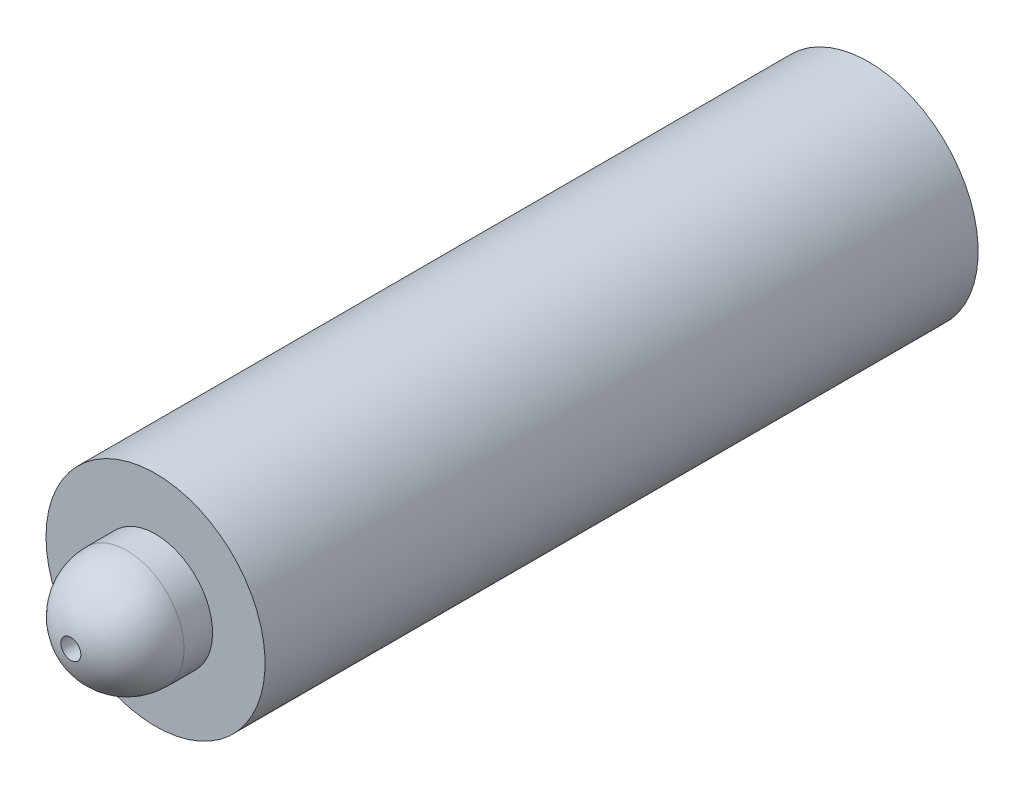
from build123d import *

# Parameters (mm, degrees)
SKETCH1_R           = 12.192
SKETCH1_R_2         = 9.017
CORE_EXTRUDE_DEPTH  = 79.375
GROOVE_CUT_DEPTH    = 19.05
BUMPY_START         = -3.175
SKETCH3_R           = 9.017
BUMPY_EXTRUDE_DEPTH = 3.175
SKETCH7_R           = 1.11125
CUT_EXTRUDE3_DEPTH  = 79.126370247


with BuildPart() as part:
    # Sketch1 → Core Extrude (new body)
    with BuildSketch(Plane.XY):
        with Locations(Location((0, 0, 0), (0, 0, 180))):
            Circle(SKETCH1_R)
        with Locations(Location((0, 0, 0), (0, 0, 180))):
            Circle(SKETCH1_R_2, mode=Mode.SUBTRACT)
    extrude(amount=CORE_EXTRUDE_DEPTH)

    # Sketch2 → Groove Cut (cut)
    with BuildSketch(Plane(origin=(0, 0, 0), x_dir=(-1, 0, 0), z_dir=(0, 0, -1))):
        with BuildLine():
            ThreePointArc((-8.439529845, -3.175), (-9.017, 0), (-8.439529845, 3.175))
            ThreePointArc((-8.439529845, 3.175), (-10.922, 0), (-8.439529845, -3.175))
        make_face()
        with BuildLine():
            ThreePointArc((-3.175, 8.439529845), (0, 9.017), (3.175, 8.439529845))
            ThreePointArc((3.175, 8.439529845), (0, 10.922), (-3.175, 8.439529845))
        make_face()
        with BuildLine():
            ThreePointArc((8.439529845, -3.175), (10.922, 0), (8.439529845, 3.175))
            ThreePointArc((8.439529845, 3.175), (8.871457874, 1.613543986), (9.017, 0))
            ThreePointArc((9.017, 0), (8.871457874, -1.613543986), (8.439529845, -3.175))
        make_face()
        with BuildLine():
            ThreePointArc((-3.175, -8.439529845), (0, -10.922), (3.175, -8.439529845))
            ThreePointArc((3.175, -8.439529845), (0, -9.017), (-3.175, -8.439529845))
        make_face()
    extrude(amount=-GROOVE_CUT_DEPTH, mode=Mode.SUBTRACT)

    # Sketch3 → Bumpy Extrude (add)
    with BuildSketch(Plane.XY.offset(79.375).offset(BUMPY_START)):
        with Locations(Location((0, 0, 0), (0, 0, 159.383409617))):
            Circle(SKETCH3_R)
    extrude(amount=BUMPY_EXTRUDE_DEPTH)

    # Sketch5 → Revolve1 (revolve)
    with BuildSketch(Plane(origin=(0, 0, 0), x_dir=(0, 0, -1), z_dir=(1, 0, 0))):
        with BuildLine():
            Line((-88.9, 0), (-79.375, 0))
            Line((-79.375, 0), (-79.375, 6.35))
            Line((-79.375, 6.35), (-82.55, 6.35))
            ThreePointArc((-82.55, 6.35), (-87.040128061, 4.490128061), (-88.9, 0))
        make_face()
    revolve(axis=Axis((0, 0, 79.375), (0, 0, 1)))

    # Sketch7 → Cut-Extrude3 (cut, through all)
    with BuildSketch(Plane(origin=(0, 0, 76.2), x_dir=(-1, 0, 0), z_dir=(0, 0, -1))):
        Circle(SKETCH7_R)
    extrude(amount=-CUT_EXTRUDE3_DEPTH, mode=Mode.SUBTRACT)


solid = part.part
